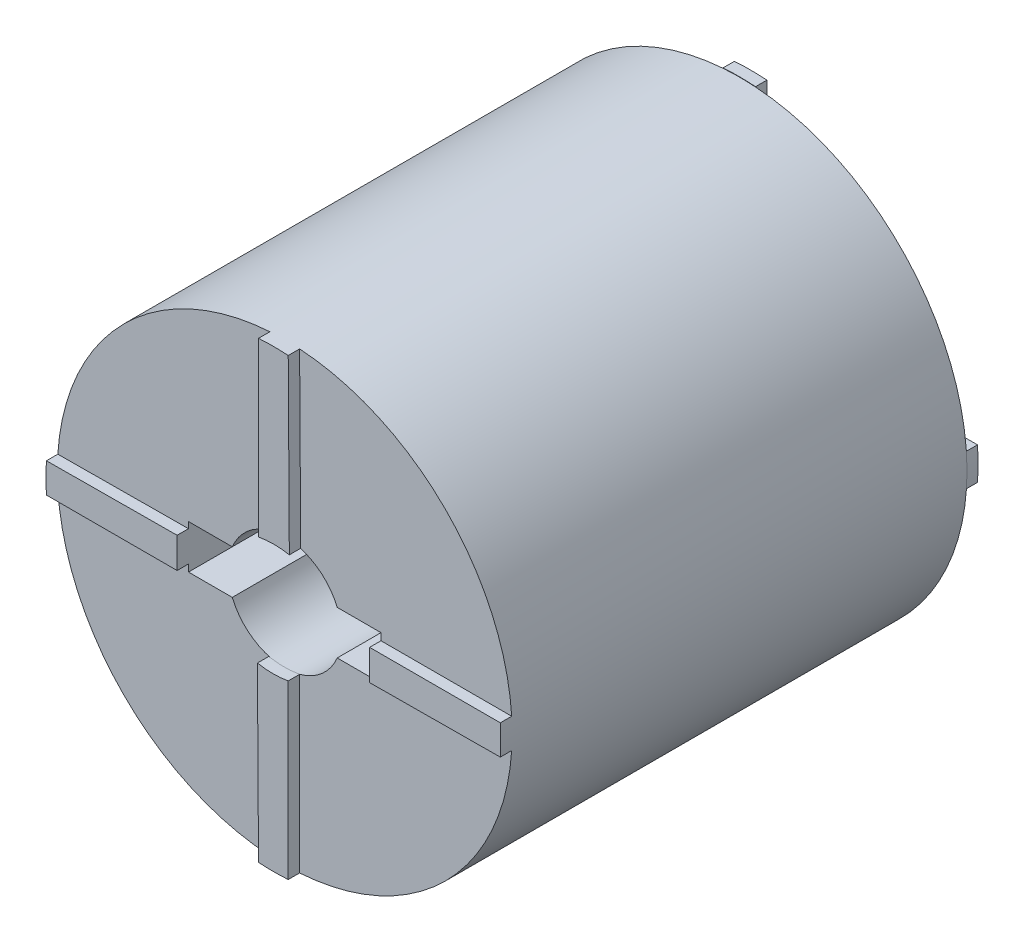
from build123d import *

# Parameters (mm, degrees)
SKETCH1_R           = 40
BOSS_EXTRUDE1_DEPTH = 80
SKETCH2_R           = 10
CUT_EXTRUDE1_DEPTH  = 50
BOSS_EXTRUDE3_DEPTH = 2
SKETCH7_R           = 10
CUT_EXTRUDE2_DEPTH  = 40
CUT_EXTRUDE3_DEPTH  = 86
BOSS_EXTRUDE5_START = 2
BOSS_EXTRUDE5_DEPTH = 2
SKETCH14_W          = 33.858331452
SKETCH14_H          = 7.7
CUT_EXTRUDE6_DEPTH  = 9


with BuildPart() as part:
    # Sketch1 → Boss-Extrude1 (new body)
    with BuildSketch(Plane.XY):
        Circle(SKETCH1_R)
    extrude(amount=-BOSS_EXTRUDE1_DEPTH)

    # Sketch2 → Cut-Extrude1 (cut)
    with BuildSketch(Plane.XY):
        Circle(SKETCH2_R)
    extrude(amount=-CUT_EXTRUDE1_DEPTH, mode=Mode.SUBTRACT)

    # Sketch5 → Boss-Extrude3 (add)
    with BuildSketch(Plane(origin=(0, 0, -80), x_dir=(-1, 0, 0), z_dir=(0, 0, -1))):
        with BuildLine():
            Line((-2.80604214, 39.953294916), (-2.80604214, 9.637548447))
            ThreePointArc((-2.80604214, 9.637548447), (0.055803254, 10.055803254), (2.917648647, 9.637548447))
            Line((2.917648647, 9.637548447), (2.917648647, 39.953294916))
            ThreePointArc((2.917648647, 39.953294916), (0.055803254, 40.055803254), (-2.80604214, 39.953294916))
        make_face()
        with BuildLine():
            Line((39.953294916, 2.917648647), (9.637548447, 2.917648647))
            ThreePointArc((9.637548447, 2.917648647), (10.055803254, 0.055803254), (9.637548447, -2.80604214))
            Line((9.637548447, -2.80604214), (39.953294916, -2.80604214))
            ThreePointArc((39.953294916, -2.80604214), (40.055803254, 0.055803254), (39.953294916, 2.917648647))
        make_face()
        with BuildLine():
            Line((2.917648647, -39.841688409), (2.917648647, -9.525941939))
            ThreePointArc((2.917648647, -9.525941939), (0.055803254, -9.944196746), (-2.80604214, -9.525941939))
            Line((-2.80604214, -9.525941939), (-2.80604214, -39.841688409))
            ThreePointArc((-2.80604214, -39.841688409), (0.055803254, -39.944196746), (2.917648647, -39.841688409))
        make_face()
        with BuildLine():
            Line((-39.841688409, -2.80604214), (-9.525941939, -2.80604214))
            ThreePointArc((-9.525941939, -2.80604214), (-9.944196746, 0.055803254), (-9.525941939, 2.917648647))
            Line((-9.525941939, 2.917648647), (-39.841688409, 2.917648647))
            ThreePointArc((-39.841688409, 2.917648647), (-39.944196746, 0.055803254), (-39.841688409, -2.80604214))
        make_face()
    extrude(amount=BOSS_EXTRUDE3_DEPTH)

    # Sketch7 → Cut-Extrude2 (cut)
    with BuildSketch(Plane.XY.offset(-50)):
        Circle(SKETCH7_R)
    extrude(amount=-CUT_EXTRUDE2_DEPTH, mode=Mode.SUBTRACT)

    # Sketch10 → Cut-Extrude3 (cut)
    with BuildSketch(Plane.XY):
        with BuildLine():
            ThreePointArc((-9.229165726, -3.85), (-10, 0), (-9.229165726, 3.85))
            Line((-9.229165726, 3.85), (-16.929165726, 3.85))
            Line((-16.929165726, 3.85), (-16.929165726, -3.85))
            Line((-16.929165726, -3.85), (-9.229165726, -3.85))
        make_face()
        with BuildLine():
            Line((16.929165726, 3.85), (9.229165726, 3.85))
            ThreePointArc((9.229165726, 3.85), (9.805397933, 1.963204363), (10, 0))
            ThreePointArc((10, 0), (9.805397933, -1.963204363), (9.229165726, -3.85))
            Line((9.229165726, -3.85), (16.929165726, -3.85))
            Line((16.929165726, -3.85), (16.929165726, 3.85))
        make_face()
    extrude(amount=-CUT_EXTRUDE3_DEPTH, mode=Mode.SUBTRACT)

    # Sketch12 → Boss-Extrude5 (add)
    with BuildSketch(Plane.XY.offset(BOSS_EXTRUDE5_START)):
        with BuildLine():
            Line((-2.61385984, 39.914505342), (-2.61385984, 9.652343588))
            ThreePointArc((-2.61385984, 9.652343588), (0.096784019, 9.898764617), (2.80604214, 9.637548447))
            Line((2.80604214, 9.637548447), (2.61385984, 39.914505342))
            ThreePointArc((2.61385984, 39.914505342), (0, 40), (-2.61385984, 39.914505342))
        make_face()
        with BuildLine():
            Line((39.914505342, 2.61385984), (9.652343588, 2.61385984))
            ThreePointArc((9.652343588, 2.61385984), (9.898764617, -0.096784019), (9.637548447, -2.80604214))
            Line((9.637548447, -2.80604214), (39.914505342, -2.61385984))
            ThreePointArc((39.914505342, -2.61385984), (40, 0), (39.914505342, 2.61385984))
        make_face()
        with BuildLine():
            Line((2.61385984, -39.914505342), (2.61385984, -9.652343588))
            ThreePointArc((2.61385984, -9.652343588), (-0.096784019, -9.898764617), (-2.80604214, -9.637548447))
            Line((-2.80604214, -9.637548447), (-2.61385984, -39.914505342))
            ThreePointArc((-2.61385984, -39.914505342), (0, -40), (2.61385984, -39.914505342))
        make_face()
        with BuildLine():
            Line((-39.914505342, -2.61385984), (-9.652343588, -2.61385984))
            ThreePointArc((-9.652343588, -2.61385984), (-9.898764617, 0.096784019), (-9.637548447, 2.80604214))
            Line((-9.637548447, 2.80604214), (-39.914505342, 2.61385984))
            ThreePointArc((-39.914505342, 2.61385984), (-40, 0), (-39.914505342, -2.61385984))
        make_face()
    extrude(amount=-BOSS_EXTRUDE5_DEPTH)

    # Sketch14 → Cut-Extrude6 (cut)
    with BuildSketch(Plane.XY.offset(2)):
        Rectangle(SKETCH14_W, SKETCH14_H)
    extrude(amount=-CUT_EXTRUDE6_DEPTH, mode=Mode.SUBTRACT)


solid = part.part
